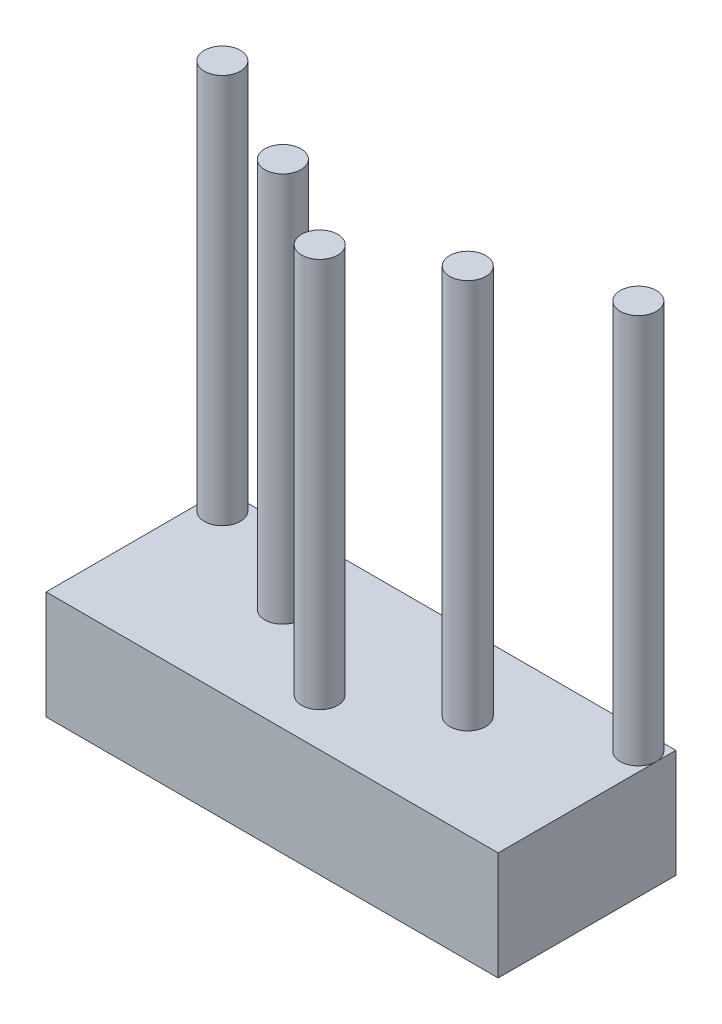
from build123d import *

# Parameters (mm, degrees)
SKETCH1_W           = 79.502
SKETCH1_H           = 31.242
BOSS_EXTRUDE1_DEPTH = 19.05
SKETCH2_R           = 3.175
BOSS_EXTRUDE2_DEPTH = 68.58


with BuildPart() as part:
    # Sketch1 → Boss-Extrude1 (new body)
    with BuildSketch(Plane(origin=(0, 0, 0), x_dir=(1, 0, 0), z_dir=(0, 1, 0))):
        Rectangle(SKETCH1_W, SKETCH1_H)
    extrude(amount=BOSS_EXTRUDE1_DEPTH)

    # Sketch2 → Boss-Extrude2 (add)
    with BuildSketch(Plane(origin=(0, 19.05, 0), x_dir=(1, 0, 0), z_dir=(0, 1, 0))):
        with Locations(Location((-36.576, 12.192, 0), (0, 0, 180))):
            Circle(SKETCH2_R)
        with Locations(Location((-16.256, 2.515131479, 0), (0, 0, 270))):
            Circle(SKETCH2_R)
        with Locations(Location((0, -7.263868521, 0), (0, 0, 270))):
            Circle(SKETCH2_R)
        with Locations(Location((16.256, 2.515131479, 0), (0, 0, 270))):
            Circle(SKETCH2_R)
        with Locations((36.576, 12.192)):
            Circle(SKETCH2_R)
    extrude(amount=BOSS_EXTRUDE2_DEPTH)


solid = part.part
